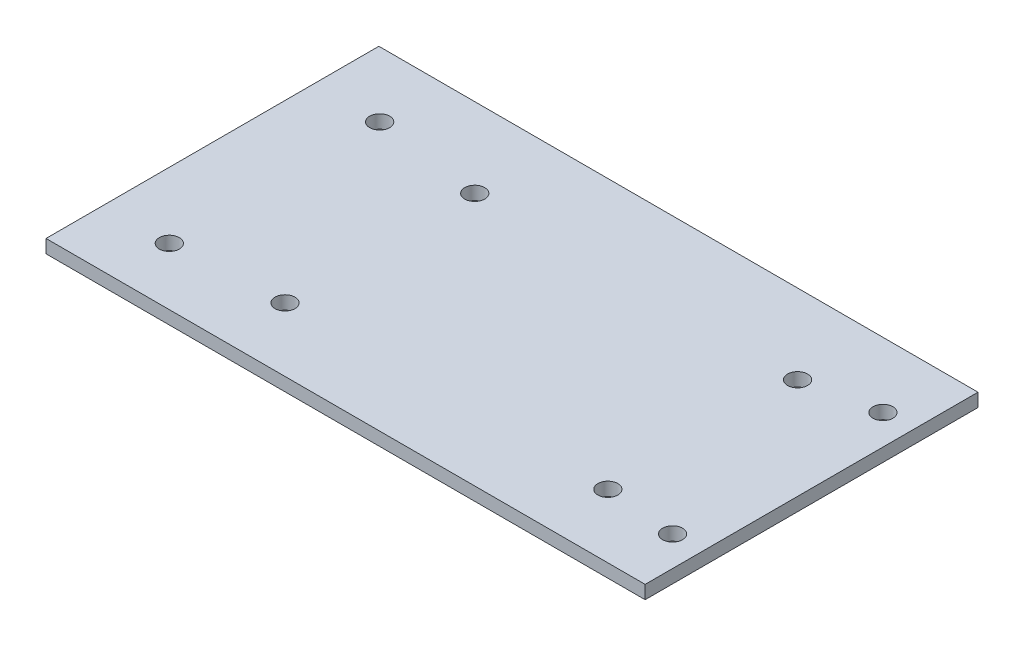
from build123d import *

# Parameters (mm, degrees)
SKETCH_1_W      = 90
SKETCH_1_H      = 50
SKETCH_1_R      = 1.5
EXTRUDE_1_DEPTH = 2


with BuildPart() as part:
    # 草图1 → 凸台-拉伸1 (new body)
    with BuildSketch(Plane(origin=(0, 0, 0), x_dir=(1, 0, 0), z_dir=(0, 1, 0))):
        with Locations((45, 25)):
            Rectangle(SKETCH_1_W, SKETCH_1_H)
        with Locations(Location((26.334632344, 38.067690399, 0), (0, 0, 270))):
            Circle(SKETCH_1_R, mode=Mode.SUBTRACT)
        with Locations(Location((74.834632344, 38.067690399, 0), (0, 0, 270))):
            Circle(SKETCH_1_R, mode=Mode.SUBTRACT)
        with Locations(Location((74.834632344, 9.567690399, 0), (0, 0, 270))):
            Circle(SKETCH_1_R, mode=Mode.SUBTRACT)
        with Locations(Location((26.334632344, 9.567690399, 0), (0, 0, 270))):
            Circle(SKETCH_1_R, mode=Mode.SUBTRACT)
        with Locations(Location((9.899403272, 40.22170825, 0), (0, 0, 270))):
            Circle(SKETCH_1_R, mode=Mode.SUBTRACT)
        with Locations(Location((85.499403272, 40.22170825, 0), (0, 0, 270))):
            Circle(SKETCH_1_R, mode=Mode.SUBTRACT)
        with Locations(Location((85.499403272, 8.62170825, 0), (0, 0, 270))):
            Circle(SKETCH_1_R, mode=Mode.SUBTRACT)
        with Locations(Location((9.899403272, 8.62170825, 0), (0, 0, 270))):
            Circle(SKETCH_1_R, mode=Mode.SUBTRACT)
    extrude(amount=EXTRUDE_1_DEPTH)


solid = part.part
